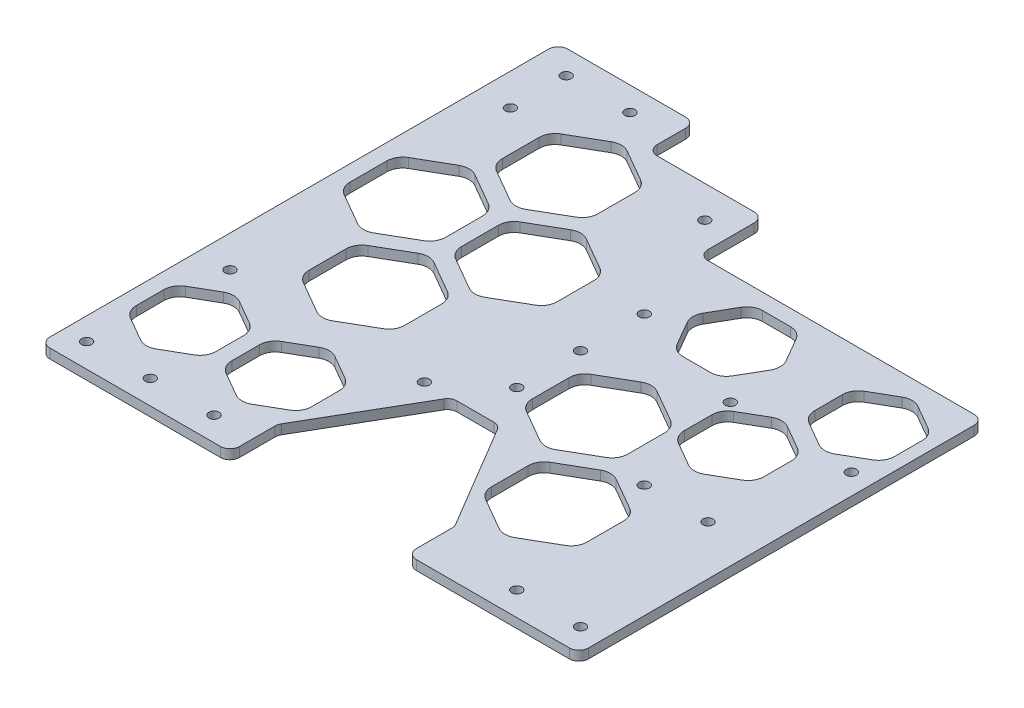
from build123d import *

# Parameters (mm, degrees)
SKETCH_1_R          = 1.6
EXTRUDE_1_DEPTH     = 3
CUT_EXTRUDE_1_DEPTH = 7
CUT_EXTRUDE_2_DEPTH = 147.544361884
CUT_EXTRUDE_3_DEPTH = 10
FILLET_2_R          = 5
FILLET_1_R          = 3


with BuildPart() as part:
    # 草图1 → 凸台-拉伸1 (new body)
    with BuildSketch(Plane(origin=(0, 0, 0), x_dir=(1, 0, 0), z_dir=(0, 1, 0))):
        Polygon((-36.5, 116), (-36.5, 101), (0, 101), (0, 80.5), (15, 80.5), (45, 80.5), (89.5, 80.5), (89.5, 53.5), (89.5, -31.5), (89.5, -46.5), (35.5, -46.5), (35.5, -31.5), (15, 3), (0, 3), (-20, -31.5), (-20, -46.5), (-79.5, -46.5), (-79.5, 101), (-79.5, 116), align=None)
        with Locations(Location((7.5, 16, 0), (0, 0, 270))):
            Circle(SKETCH_1_R, mode=Mode.SUBTRACT)
        with Locations(Location((7.5, 36, 0), (0, 0, 270))):
            Circle(SKETCH_1_R, mode=Mode.SUBTRACT)
        with Locations(Location((7.5, 56, 0), (0, 0, 270))):
            Circle(SKETCH_1_R, mode=Mode.SUBTRACT)
        with Locations(Location((-49.5, 108.5, 0), (0, 0, 270))):
            Circle(SKETCH_1_R, mode=Mode.SUBTRACT)
        with Locations(Location((-69.5, 108.5, 0), (0, 0, 270))):
            Circle(SKETCH_1_R, mode=Mode.SUBTRACT)
        with Locations(Location((82.5, -39, 0), (0, 0, 270))):
            Circle(SKETCH_1_R, mode=Mode.SUBTRACT)
        with Locations(Location((62.5, -39, 0), (0, 0, 270))):
            Circle(SKETCH_1_R, mode=Mode.SUBTRACT)
        with Locations(Location((-32.5, -39, 0), (0, 0, 270))):
            Circle(SKETCH_1_R, mode=Mode.SUBTRACT)
        with Locations(Location((-52.5, -39, 0), (0, 0, 270))):
            Circle(SKETCH_1_R, mode=Mode.SUBTRACT)
        with Locations(Location((-72.5, -39, 0), (0, 0, 270))):
            Circle(SKETCH_1_R, mode=Mode.SUBTRACT)
        with Locations(Location((-69.5, 91, 0), (0, 0, 270))):
            Circle(SKETCH_1_R, mode=Mode.SUBTRACT)
        with Locations(Location((-8.5, 91, 0), (0, 0, 270))):
            Circle(SKETCH_1_R, mode=Mode.SUBTRACT)
        with Locations(Location((-8.5, 3, 0), (0, 0, 270))):
            Circle(SKETCH_1_R, mode=Mode.SUBTRACT)
        with Locations(Location((-69.5, 3, 0), (0, 0, 270))):
            Circle(SKETCH_1_R, mode=Mode.SUBTRACT)
        with Locations(Location((83, 45.5, 0), (0, 0, 270))):
            Circle(SKETCH_1_R, mode=Mode.SUBTRACT)
        with Locations(Location((74, 9.5, 0), (0, 0, 270))):
            Circle(SKETCH_1_R, mode=Mode.SUBTRACT)
        with Locations(Location((54, 9.5, 0), (0, 0, 270))):
            Circle(SKETCH_1_R, mode=Mode.SUBTRACT)
        with Locations(Location((45, 45.5, 0), (0, 0, 270))):
            Circle(SKETCH_1_R, mode=Mode.SUBTRACT)
    extrude(amount=EXTRUDE_1_DEPTH)

    # 草图3 → 切除-拉伸1 (cut)
    with BuildSketch(Plane(origin=(0, 3, 0), x_dir=(1, 0, 0), z_dir=(0, 1, 0))):
        Polygon((-42, 64.432667397), (-27, 73.092921435), (-27, 90.413429511), (-42, 99.073683549), (-57, 90.413429511), (-57, 73.092921435), align=None)
        Polygon((-59.5, 34.121778265), (-44.5, 42.782032303), (-44.5, 60.102540378), (-59.5, 68.762794416), (-74.5, 60.102540378), (-74.5, 42.782032303), align=None)
        Polygon((-24.5, 34.121778265), (-9.5, 42.782032303), (-9.5, 60.102540378), (-24.5, 68.762794416), (-39.5, 60.102540378), (-39.5, 42.782032303), align=None)
        Polygon((-42, 3.810889132), (-27, 12.47114317), (-27, 29.791651246), (-42, 38.451905284), (-57, 29.791651246), (-57, 12.47114317), align=None)
        Polygon((28, 3.810889132), (43, 12.47114317), (43, 29.791651246), (28, 38.451905284), (13, 29.791651246), (13, 12.47114317), align=None)
        Polygon((45.5, -26.5), (60.5, -17.839745962), (60.5, -0.519237886), (45.5, 8.141016151), (30.5, -0.519237886), (30.5, -17.839745962), align=None)
    extrude(amount=-CUT_EXTRUDE_1_DEPTH, mode=Mode.SUBTRACT)

    # 草图4 → 切除-拉伸2 (cut, through all)
    with BuildSketch(Plane(origin=(0, 3, 0), x_dir=(1, 0, 0), z_dir=(0, 1, 0))):
        Polygon((-62, -2.632486541), (-74.5, -9.849364905), (-74.5, -24.283121635), (-62, -31.5), (-49.5, -24.283121635), (-49.5, -9.849364905), align=None)
        Polygon((-32, -2.632486541), (-44.5, -9.849364905), (-44.5, -24.283121635), (-32, -31.5), (-19.5, -24.283121635), (-19.5, -9.849364905), align=None)
        Polygon((58, 49.329037687), (45.5, 42.112159322), (45.5, 27.678402592), (58, 20.461524227), (70.5, 27.678402592), (70.5, 42.112159322), align=None)
        Polygon((73, 75.3097998), (60.5, 68.092921435), (60.5, 53.659164705), (73, 46.442286341), (85.5, 53.659164705), (85.5, 68.092921435), align=None)
    extrude(amount=-CUT_EXTRUDE_2_DEPTH, mode=Mode.SUBTRACT)

    # 草图5 → 切除-拉伸3 (cut)
    with BuildSketch(Plane(origin=(0, 3, 0), x_dir=(1, 0, 0), z_dir=(0, 1, 0))):
        Polygon((43.93375673, 63), (36.716878365, 75.5), (22.283121635, 75.5), (15.06624327, 63), (22.283121635, 50.5), (36.716878365, 50.5), align=None)
    extrude(amount=-CUT_EXTRUDE_3_DEPTH, mode=Mode.SUBTRACT)

    # 圆角2
    fillet_2_edges = [part.edges().sort_by_distance(p)[0] for p in [
        (28, 1.5, -3.810889132),
        (13, 1.5, -12.47114317),
        (13, 1.5, -29.791651246),
        (28, 1.5, -38.451905284),
        (43, 1.5, -29.791651246),
        (43, 1.5, -12.47114317),
        (-42, 1.5, -3.810889132),
        (-57, 1.5, -12.47114317),
        (-57, 1.5, -29.791651246),
        (-42, 1.5, -38.451905284),
        (-27, 1.5, -29.791651246),
        (-27, 1.5, -12.47114317),
        (-24.5, 1.5, -34.121778265),
        (-39.5, 1.5, -42.782032303),
        (-39.5, 1.5, -60.102540378),
        (-24.5, 1.5, -68.762794416),
        (-9.5, 1.5, -60.102540378),
        (-9.5, 1.5, -42.782032303),
        (-59.5, 1.5, -34.121778265),
        (-74.5, 1.5, -42.782032303),
        (-74.5, 1.5, -60.102540378),
        (-59.5, 1.5, -68.762794416),
        (-44.5, 1.5, -60.102540378),
        (-44.5, 1.5, -42.782032303),
        (45.5, 1.5, 26.5),
        (30.5, 1.5, 17.839745962),
        (30.5, 1.5, 0.519237886),
        (45.5, 1.5, -8.141016151),
        (60.5, 1.5, 0.519237886),
        (60.5, 1.5, 17.839745962),
        (-42, 1.5, -64.432667397),
        (-57, 1.5, -73.092921435),
        (-57, 1.5, -90.413429511),
        (-42, 1.5, -99.073683549),
        (-27, 1.5, -90.413429511),
        (-27, 1.5, -73.092921435),
        (-62, 1.5, 2.632486541),
        (-49.5, 1.5, 9.849364905),
        (-49.5, 1.5, 24.283121635),
        (-62, 1.5, 31.5),
        (-74.5, 1.5, 24.283121635),
        (-74.5, 1.5, 9.849364905),
        (73, 1.5, -75.3097998),
        (85.5, 1.5, -68.092921435),
        (85.5, 1.5, -53.659164705),
        (73, 1.5, -46.442286341),
        (60.5, 1.5, -53.659164705),
        (60.5, 1.5, -68.092921435),
        (58, 1.5, -49.329037687),
        (70.5, 1.5, -42.112159322),
        (70.5, 1.5, -27.678402592),
        (58, 1.5, -20.461524227),
        (45.5, 1.5, -27.678402592),
        (45.5, 1.5, -42.112159322),
        (-32, 1.5, 2.632486541),
        (-19.5, 1.5, 9.849364905),
        (-19.5, 1.5, 24.283121635),
        (-32, 1.5, 31.5),
        (-44.5, 1.5, 24.283121635),
        (-44.5, 1.5, 9.849364905),
        (43.93375673, 1.5, -63),
        (36.716878365, 1.5, -50.5),
        (22.283121635, 1.5, -50.5),
        (15.06624327, 1.5, -63),
        (22.283121635, 1.5, -75.5),
        (36.716878365, 1.5, -75.5),
    ]]
    fillet(fillet_2_edges, radius=FILLET_2_R)

    # 圆角1
    fillet_1_edges = [part.edges().sort_by_distance(p)[0] for p in [
        (-79.5, 1.5, -116),
        (-36.5, 1.5, -116),
        (-36.5, 1.5, -101),
        (0, 1.5, -101),
        (0, 1.5, -80.5),
        (89.5, 1.5, -80.5),
        (89.5, 1.5, 46.5),
        (35.5, 1.5, 46.5),
        (35.5, 1.5, 31.5),
        (15, 1.5, -3),
        (0, 1.5, -3),
        (-20, 1.5, 31.5),
        (-20, 1.5, 46.5),
        (-79.5, 1.5, 46.5),
    ]]
    fillet(fillet_1_edges, radius=FILLET_1_R)


solid = part.part
